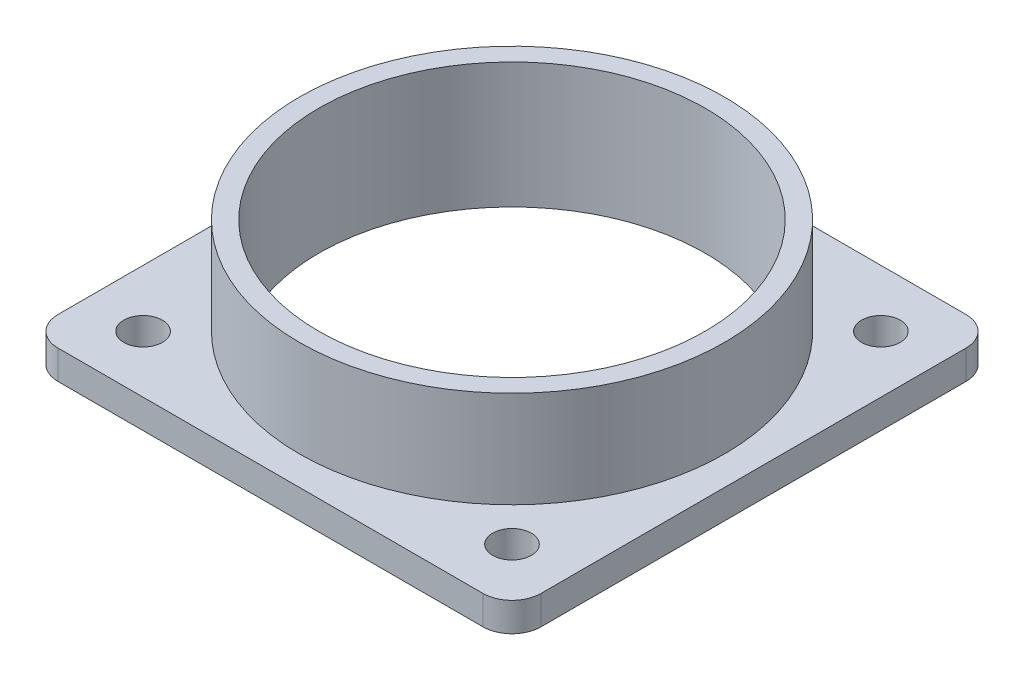
from build123d import *

# Parameters (mm, degrees)
SKETCH1_R           = 2
SKETCH1_R_2         = 20
BOSS_EXTRUDE1_DEPTH = 3
FILLET2_R           = 3
SKETCH2_R           = 22
SKETCH2_R_2         = 20
BOSS_EXTRUDE3_DEPTH = 10


with BuildPart() as part:
    # Sketch1 → Boss-Extrude1 (new body)
    with BuildSketch(Plane(origin=(0, 0, 0), x_dir=(1, 0, 0), z_dir=(0, 1, 0))):
        Polygon((0, 25), (-25, 25), (-25, -25), (25, -25), (25, 25), align=None)
        with Locations(Location((-19.091883092, 19.091883092, 0), (0, 0, 270))):
            Circle(SKETCH1_R, mode=Mode.SUBTRACT)
        with Locations(Location((19.091883092, 19.091883092, 0), (0, 0, 270))):
            Circle(SKETCH1_R, mode=Mode.SUBTRACT)
        with Locations(Location((19.091883092, -19.091883092, 0), (0, 0, 270))):
            Circle(SKETCH1_R, mode=Mode.SUBTRACT)
        with Locations(Location((-19.091883092, -19.091883092, 0), (0, 0, 270))):
            Circle(SKETCH1_R, mode=Mode.SUBTRACT)
        with Locations(Location((0, 0, 0), (0, 0, 270))):
            Circle(SKETCH1_R_2, mode=Mode.SUBTRACT)
    extrude(amount=BOSS_EXTRUDE1_DEPTH)

    # Fillet2
    fillet2_edges = [part.edges().sort_by_distance(p)[0] for p in [
        (25, 1.5, -25),
        (25, 1.5, 25),
        (-25, 1.5, 25),
        (-25, 1.5, -25),
    ]]
    fillet(fillet2_edges, radius=FILLET2_R)

    # Sketch2 → Boss-Extrude3 (add)
    with BuildSketch(Plane(origin=(0, 3, 0), x_dir=(1, 0, 0), z_dir=(0, 1, 0))):
        with Locations(Location((0, 0, 0), (0, 0, 270))):
            Circle(SKETCH2_R)
        with Locations(Location((0, 0, 0), (0, 0, 270))):
            Circle(SKETCH2_R_2, mode=Mode.SUBTRACT)
    extrude(amount=BOSS_EXTRUDE3_DEPTH)


solid = part.part
